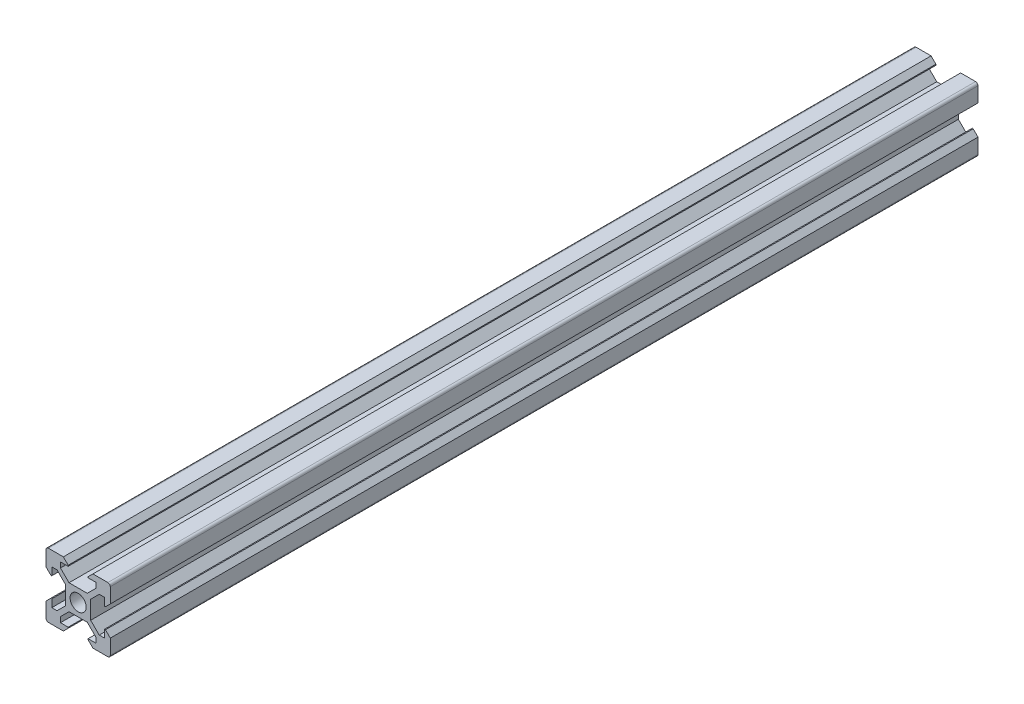
from build123d import *

# Parameters (mm, degrees)
CROQUIS1_R              = 2.5
SALIENTE_EXTRUIR1_DEPTH = 300
CUT_EXTRUDE1_DEPTH      = 47
CUT_EXTRUDE1_DEPTH_BACK = 40
SKETCH2_W               = 139.582587955
SKETCH2_H               = 242.432915921


with BuildPart() as part:
    # Croquis1 → Saliente-Extruir1 (new body)
    with BuildSketch(Plane.XY):
        with BuildLine():
            Line((-4.6, 10), (-3.1, 8.5))
            Line((-3.1, 8.5), (-3.1, 8.2))
            Line((-3.1, 8.2), (-5.5, 8.2))
            Line((-5.5, 8.2), (-5.5, 6.560660172))
            Line((-5.5, 6.560660172), (-2.84, 3.900660172))
            Line((-2.84, 3.900660172), (0, 3.900660172))
            Line((0, 3.900660172), (2.84, 3.900660172))
            Line((2.84, 3.900660172), (5.5, 6.560660172))
            Line((5.5, 6.560660172), (5.5, 8.2))
            Line((5.5, 8.2), (3.1, 8.2))
            Line((3.1, 8.2), (3.1, 8.5))
            Line((3.1, 8.5), (4.6, 10))
            Line((4.6, 10), (9.25, 10))
            ThreePointArc((9.25, 10), (9.780330086, 9.780330086), (10, 9.25))
            Line((10, 9.25), (10, 4.6))
            Line((10, 4.6), (8.5, 3.1))
            Line((8.5, 3.1), (8.2, 3.1))
            Line((8.2, 3.1), (8.2, 5.5))
            Line((8.2, 5.5), (6.560660172, 5.5))
            Line((6.560660172, 5.5), (3.900660172, 2.84))
            Line((3.900660172, 2.84), (3.900660172, 0))
            Line((3.900660172, 0), (3.900660172, -2.84))
            Line((3.900660172, -2.84), (6.560660172, -5.5))
            Line((6.560660172, -5.5), (8.2, -5.5))
            Line((8.2, -5.5), (8.2, -3.1))
            Line((8.2, -3.1), (8.5, -3.1))
            Line((8.5, -3.1), (10, -4.6))
            Line((10, -4.6), (10, -9.25))
            ThreePointArc((10, -9.25), (9.780330086, -9.780330086), (9.25, -10))
            Line((9.25, -10), (4.6, -10))
            Line((4.6, -10), (3.1, -8.5))
            Line((3.1, -8.5), (3.1, -8.2))
            Line((3.1, -8.2), (5.5, -8.2))
            Line((5.5, -8.2), (5.5, -6.560660172))
            Line((5.5, -6.560660172), (2.84, -3.900660172))
            Line((2.84, -3.900660172), (0, -3.900660172))
            Line((0, -3.900660172), (-2.84, -3.900660172))
            Line((-2.84, -3.900660172), (-5.5, -6.560660172))
            Line((-5.5, -6.560660172), (-5.5, -8.2))
            Line((-5.5, -8.2), (-3.1, -8.2))
            Line((-3.1, -8.2), (-3.1, -8.5))
            Line((-3.1, -8.5), (-4.6, -10))
            Line((-4.6, -10), (-9.25, -10))
            ThreePointArc((-9.25, -10), (-9.780330086, -9.780330086), (-10, -9.25))
            Line((-10, -9.25), (-10, -4.6))
            Line((-10, -4.6), (-8.5, -3.1))
            Line((-8.5, -3.1), (-8.2, -3.1))
            Line((-8.2, -3.1), (-8.2, -5.5))
            Line((-8.2, -5.5), (-6.560660172, -5.5))
            Line((-6.560660172, -5.5), (-3.900660172, -2.84))
            Line((-3.900660172, -2.84), (-3.900660172, 0))
            Line((-3.900660172, 0), (-3.900660172, 2.84))
            Line((-3.900660172, 2.84), (-6.560660172, 5.5))
            Line((-6.560660172, 5.5), (-8.2, 5.5))
            Line((-8.2, 5.5), (-8.2, 3.1))
            Line((-8.2, 3.1), (-8.5, 3.1))
            Line((-8.5, 3.1), (-10, 4.6))
            Line((-10, 4.6), (-10, 9.25))
            ThreePointArc((-10, 9.25), (-9.780330086, 9.780330086), (-9.25, 10))
            Line((-9.25, 10), (-4.6, 10))
        make_face()
        Circle(CROQUIS1_R, mode=Mode.SUBTRACT)
    extrude(amount=SALIENTE_EXTRUIR1_DEPTH)

    # Sketch2 → Cut-Extrude1 (cut, two sides: drawn at the far end of the back side and taken through both)
    with BuildSketch(Plane(origin=(0, 0, 0), x_dir=(1, 0, 0), z_dir=(0, 1, 0)).offset(-CUT_EXTRUDE1_DEPTH_BACK)):
        with Locations((12.355396541, -391.216457961)):
            Rectangle(SKETCH2_W, SKETCH2_H)
    extrude(amount=CUT_EXTRUDE1_DEPTH + CUT_EXTRUDE1_DEPTH_BACK, mode=Mode.SUBTRACT)


solid = part.part
